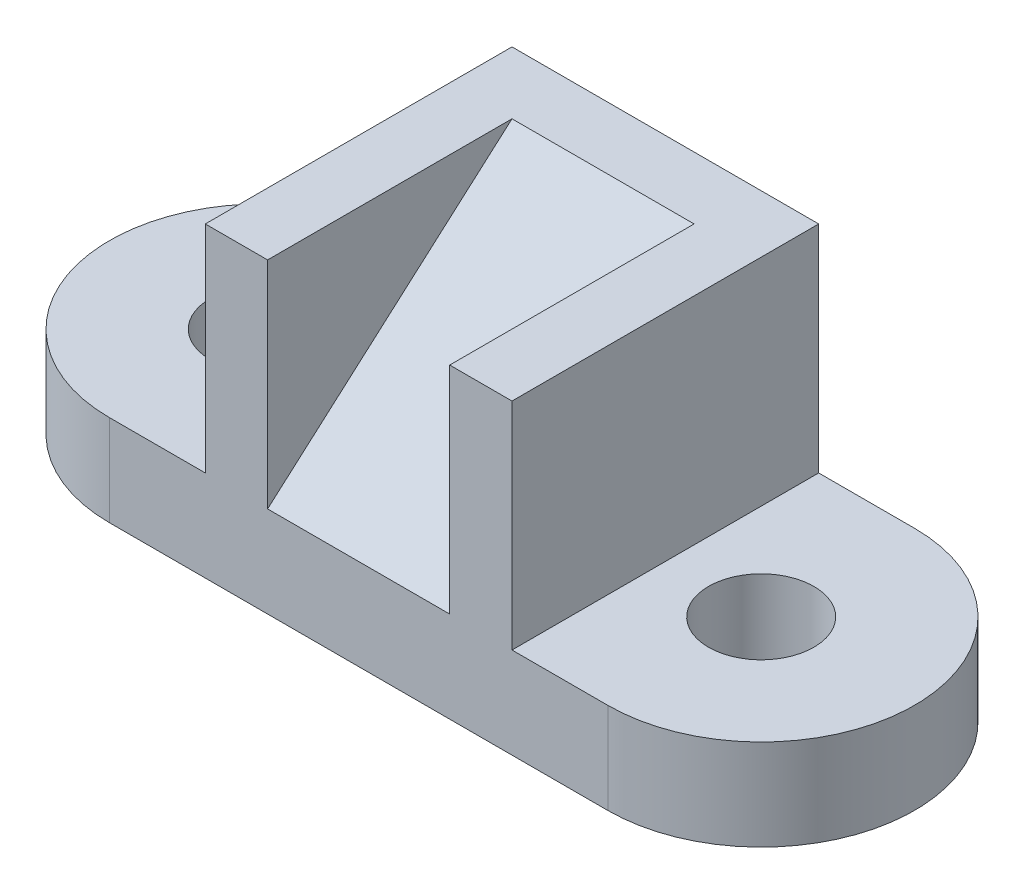
from build123d import *

# Parameters (mm, degrees)
SKETCH_2_R      = 11
EXTRUDE_1_DEPTH = 19
EXTRUDE_2_DEPTH = 45
EXTRUDE_3_DEPTH = 38


with BuildPart() as part:
    # 스케치2 → 보스-돌출1 (new body)
    with BuildSketch(Plane(origin=(0, 0, 0), x_dir=(1, 0, 0), z_dir=(0, 1, 0))):
        with BuildLine():
            Line((0, 0), (104, 0))
            ThreePointArc((104, 0), (136, 32), (104, 64))
            Line((104, 64), (0, 64))
            ThreePointArc((0, 64), (-32, 32), (0, 0))
        make_face()
        with Locations(Location((0, 32, 0), (0, 0, 270))):
            Circle(SKETCH_2_R, mode=Mode.SUBTRACT)
        with Locations(Location((104, 32, 0), (0, 0, 270))):
            Circle(SKETCH_2_R, mode=Mode.SUBTRACT)
    extrude(amount=EXTRUDE_1_DEPTH)

    # 스케치3 → 보스-돌출2 (add)
    with BuildSketch(Plane(origin=(0, 19, 0), x_dir=(1, 0, 0), z_dir=(0, 1, 0))):
        Polygon((84, 0), (84, 64), (20, 64), (20, 0), (33, 0), (33, 51), (71, 51), (71, 0), align=None)
    extrude(amount=EXTRUDE_2_DEPTH)

    # 스케치6 → 보스-돌출3 (add)
    with BuildSketch(Plane(origin=(33, 0, 0), x_dir=(0, 0, -1), z_dir=(1, 0, 0))):
        Polygon((51, 64), (0, 19), (51, 19), align=None)
    extrude(amount=EXTRUDE_3_DEPTH)


solid = part.part
